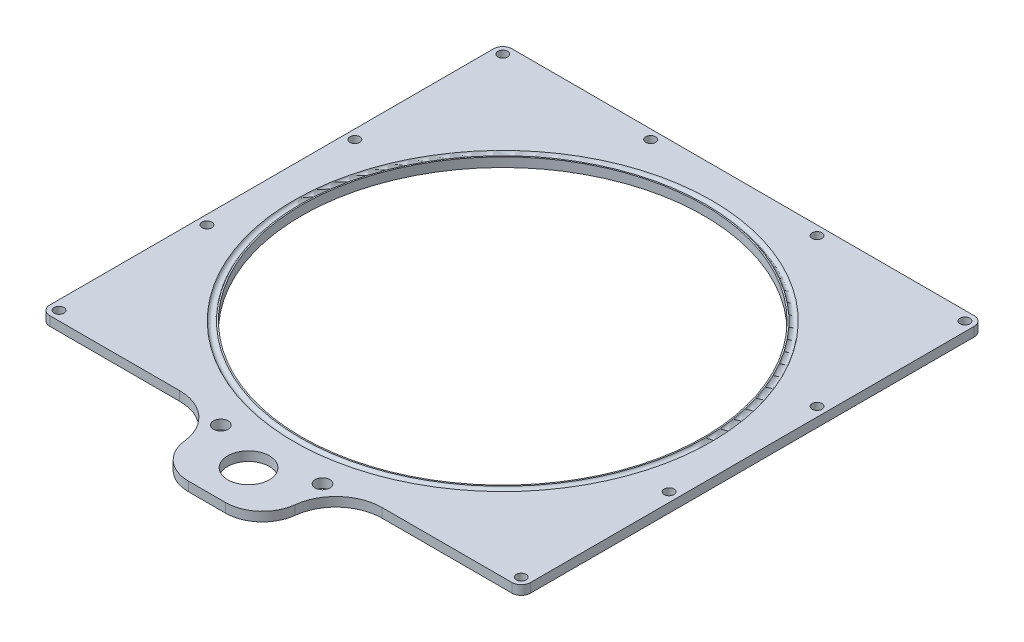
from build123d import *

# Parameters (mm, degrees)
SKETCH1_R               = 138.1125
SKETCH1_R_2             = 14.2875
BOSS_EXTRUDE1_DEPTH     = 6.35
FILLET1_R               = 25.4
FILLET2_R               = 31.75
F_3_8_CLEARANCE_HOLE1_D = 10.0838
F_1_4_CLEARANCE_HOLE1_D = 6.7564
FILLET3_R               = 6.35
SKETCH2_R               = 2.38125


with BuildPart() as part:
    # Sketch1 → Boss-Extrude1 (new body)
    with BuildSketch(Plane(origin=(0, 0, 0), x_dir=(1, 0, 0), z_dir=(0, 1, 0))):
        Polygon((38.1, -152.4), (165.1, -152.4), (165.1, 165.1), (-165.1, 165.1), (-165.1, -152.4), (-38.1, -152.4), (-38.1, -203.2), (38.1, -203.2), align=None)
        Circle(SKETCH1_R, mode=Mode.SUBTRACT)
        with Locations((0, -174.625)):
            Circle(SKETCH1_R_2, mode=Mode.SUBTRACT)
    extrude(amount=BOSS_EXTRUDE1_DEPTH)

    # Fillet1
    fillet1_edges = [part.edges().sort_by_distance(p)[0] for p in [
        (38.1, 3.175, 203.2),
        (-38.1, 3.175, 203.2),
    ]]
    fillet(fillet1_edges, radius=FILLET1_R)

    # Fillet2
    fillet2_edges = [part.edges().sort_by_distance(p)[0] for p in [
        (38.1, 3.175, 152.4),
        (-38.1, 3.175, 152.4),
    ]]
    fillet(fillet2_edges, radius=FILLET2_R)

    # 3/8 Clearance Hole1 (through all)
    with Locations(Plane(origin=(0, 0, 0), x_dir=(-1, 0, 0), z_dir=(0, -1, 0))):
        with Locations((34.925, -158.75), (-34.925, -158.75)):
            Hole(F_3_8_CLEARANCE_HOLE1_D / 2)

    # 1/4 Clearance Hole1 (through all)
    with Locations(Plane(origin=(0, 6.35, 0), x_dir=(1, 0, 0), z_dir=(0, 1, 0))):
        with Locations((158.75, 158.75), (-158.75, 158.75), (158.75, 57.15), (-158.75, 57.15), (158.75, -44.45), (-158.75, -44.45), (158.75, -146.05), (-158.75, -146.05), (-57.15, 158.75), (57.15, 158.75)):
            Hole(F_1_4_CLEARANCE_HOLE1_D / 2)

    # Fillet3
    fillet3_edges = [part.edges().sort_by_distance(p)[0] for p in [
        (-165.1, 3.175, 152.4),
        (165.1, 3.175, 152.4),
        (165.1, 3.175, -165.1),
        (-165.1, 3.175, -165.1),
    ]]
    fillet(fillet3_edges, radius=FILLET3_R)

    # Sketch2 → Cut-Revolve1 (revolve, cut)
    with BuildSketch(Plane(origin=(0, 0, 0), x_dir=(0, 0, -1), z_dir=(1, 0, 0))):
        with Locations((-141.2875, 7.14375)):
            Circle(SKETCH2_R)
        with Locations((-141.2875, -0.79375)):
            Circle(SKETCH2_R)
    revolve(axis=Axis((0, 0, 0), (0, 1, 0)), mode=Mode.SUBTRACT)


solid = part.part
